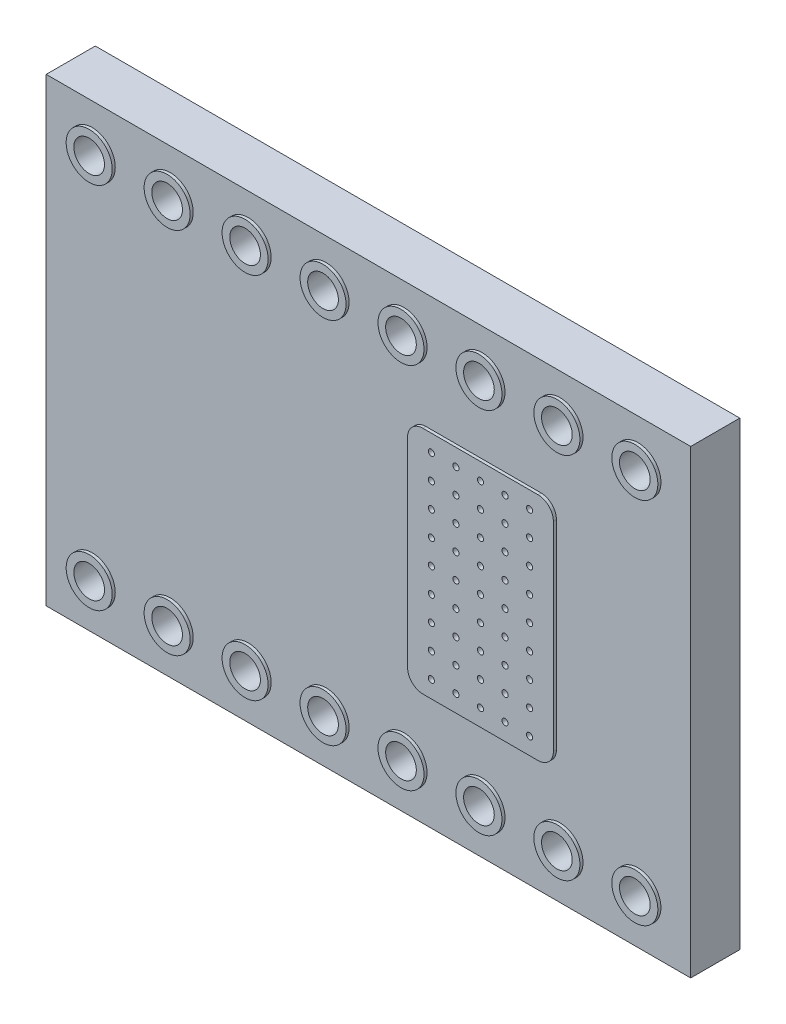
from build123d import *

# Parameters (mm, degrees)
SKETCH1_W                = 21
SKETCH1_H                = 15
BOSS_EXTRUDE1_DEPTH      = 1.6
BOSS_EXTRUDE2_DEPTH      = 0.1
BOSS_EXTRUDE2_DEPTH_BACK = 1.7
SKETCH2_R                = 0.75
SKETCH3_R                = 0.5
CUT_EXTRUDE1_DEPTH       = 2
BOSS_EXTRUDE3_DEPTH      = 0.1
BOSS_EXTRUDE3_DEPTH_BACK = 1.7
SKETCH5_R                = 0.1
CUT_EXTRUDE2_DEPTH       = 1.8


with BuildPart() as part:
    # Sketch1 → Boss-Extrude1 (new body)
    with BuildSketch(Plane.XY):
        Rectangle(SKETCH1_W, SKETCH1_H)
    extrude(amount=BOSS_EXTRUDE1_DEPTH)

    # Sketch2 → Boss-Extrude2 (add, two sides: drawn at the far end of the back side and taken through both)
    with BuildSketch(Plane.XY.offset(1.6).offset(-BOSS_EXTRUDE2_DEPTH_BACK)):
        with Locations((-9, 6)):
            Circle(SKETCH2_R)
        with Locations((-9, -6)):
            Circle(SKETCH2_R)
        with Locations((-6.46, 6)):
            Circle(SKETCH2_R)
        with Locations((-6.46, -6)):
            Circle(SKETCH2_R)
        with Locations((-3.92, 6)):
            Circle(SKETCH2_R)
        with Locations((-3.92, -6)):
            Circle(SKETCH2_R)
        with Locations((-1.38, 6)):
            Circle(SKETCH2_R)
        with Locations((-1.38, -6)):
            Circle(SKETCH2_R)
        with Locations((1.16, 6)):
            Circle(SKETCH2_R)
        with Locations((1.16, -6)):
            Circle(SKETCH2_R)
        with Locations((3.7, 6)):
            Circle(SKETCH2_R)
        with Locations((3.7, -6)):
            Circle(SKETCH2_R)
        with Locations((6.24, 6)):
            Circle(SKETCH2_R)
        with Locations((6.24, -6)):
            Circle(SKETCH2_R)
        with Locations((8.78, 6)):
            Circle(SKETCH2_R)
        with Locations((8.78, -6)):
            Circle(SKETCH2_R)
    extrude(amount=BOSS_EXTRUDE2_DEPTH + BOSS_EXTRUDE2_DEPTH_BACK)

    # Sketch3 → Cut-Extrude1 (cut)
    with BuildSketch(Plane.XY.offset(1.7)):
        with Locations((-9, 6)):
            Circle(SKETCH3_R)
        with Locations((-9, -6)):
            Circle(SKETCH3_R)
        with Locations((-6.46, 6)):
            Circle(SKETCH3_R)
        with Locations((-6.46, -6)):
            Circle(SKETCH3_R)
        with Locations((-3.92, 6)):
            Circle(SKETCH3_R)
        with Locations((-3.92, -6)):
            Circle(SKETCH3_R)
        with Locations((-1.38, 6)):
            Circle(SKETCH3_R)
        with Locations((-1.38, -6)):
            Circle(SKETCH3_R)
        with Locations((1.16, 6)):
            Circle(SKETCH3_R)
        with Locations((1.16, -6)):
            Circle(SKETCH3_R)
        with Locations((3.7, 6)):
            Circle(SKETCH3_R)
        with Locations((3.7, -6)):
            Circle(SKETCH3_R)
        with Locations((6.24, 6)):
            Circle(SKETCH3_R)
        with Locations((6.24, -6)):
            Circle(SKETCH3_R)
        with Locations((8.78, 6)):
            Circle(SKETCH3_R)
        with Locations((8.78, -6)):
            Circle(SKETCH3_R)
    extrude(amount=-CUT_EXTRUDE1_DEPTH, mode=Mode.SUBTRACT)

    # Sketch4 → Boss-Extrude3 (add, two sides: drawn at the far end of the back side and taken through both)
    with BuildSketch(Plane(origin=(0, 0, 0), x_dir=(-1, 0, 0), z_dir=(0, 0, -1)).offset(-BOSS_EXTRUDE3_DEPTH_BACK)):
        with BuildLine():
            Line((-5.625, 3.75), (-1.875, 3.75))
            ThreePointArc((-1.875, 3.75), (-1.521446609, 3.603553391), (-1.375, 3.25))
            Line((-1.375, 3.25), (-1.375, -3.25))
            ThreePointArc((-1.375, -3.25), (-1.521446609, -3.603553391), (-1.875, -3.75))
            Line((-1.875, -3.75), (-5.625, -3.75))
            ThreePointArc((-5.625, -3.75), (-5.978553391, -3.603553391), (-6.125, -3.25))
            Line((-6.125, -3.25), (-6.125, 3.25))
            ThreePointArc((-6.125, 3.25), (-5.978553391, 3.603553391), (-5.625, 3.75))
        make_face()
    extrude(amount=BOSS_EXTRUDE3_DEPTH + BOSS_EXTRUDE3_DEPTH_BACK)

    # Sketch5 → Cut-Extrude2 (cut)
    with BuildSketch(Plane(origin=(0, 0, -0.1), x_dir=(-1, 0, 0), z_dir=(0, 0, -1))):
        with Locations((-3.75, 0)):
            Circle(SKETCH5_R)
        with Locations((-2.95, 0)):
            Circle(SKETCH5_R)
        with Locations((-2.15, 0)):
            Circle(SKETCH5_R)
        with Locations((-4.55, 0)):
            Circle(SKETCH5_R)
        with Locations((-5.35, 0)):
            Circle(SKETCH5_R)
        with Locations((-3.75, -0.8)):
            Circle(SKETCH5_R)
        with Locations((-4.55, -0.8)):
            Circle(SKETCH5_R)
        with Locations((-5.35, -0.8)):
            Circle(SKETCH5_R)
        with Locations((-2.95, -0.8)):
            Circle(SKETCH5_R)
        with Locations((-2.15, -0.8)):
            Circle(SKETCH5_R)
        with Locations((-3.75, -1.6)):
            Circle(SKETCH5_R)
        with Locations((-4.55, -1.6)):
            Circle(SKETCH5_R)
        with Locations((-5.35, -1.6)):
            Circle(SKETCH5_R)
        with Locations((-2.95, -1.6)):
            Circle(SKETCH5_R)
        with Locations((-2.15, -1.6)):
            Circle(SKETCH5_R)
        with Locations((-3.75, -2.4)):
            Circle(SKETCH5_R)
        with Locations((-4.55, -2.4)):
            Circle(SKETCH5_R)
        with Locations((-5.35, -2.4)):
            Circle(SKETCH5_R)
        with Locations((-2.95, -2.4)):
            Circle(SKETCH5_R)
        with Locations((-2.15, -2.4)):
            Circle(SKETCH5_R)
        with Locations((-3.75, -3.2)):
            Circle(SKETCH5_R)
        with Locations((-4.55, -3.2)):
            Circle(SKETCH5_R)
        with Locations((-5.35, -3.2)):
            Circle(SKETCH5_R)
        with Locations((-2.95, -3.2)):
            Circle(SKETCH5_R)
        with Locations((-2.15, -3.2)):
            Circle(SKETCH5_R)
        with Locations((-3.75, 0.8)):
            Circle(SKETCH5_R)
        with Locations((-4.55, 0.8)):
            Circle(SKETCH5_R)
        with Locations((-5.35, 0.8)):
            Circle(SKETCH5_R)
        with Locations((-2.95, 0.8)):
            Circle(SKETCH5_R)
        with Locations((-2.15, 0.8)):
            Circle(SKETCH5_R)
        with Locations((-3.75, 1.6)):
            Circle(SKETCH5_R)
        with Locations((-4.55, 1.6)):
            Circle(SKETCH5_R)
        with Locations((-5.35, 1.6)):
            Circle(SKETCH5_R)
        with Locations((-2.95, 1.6)):
            Circle(SKETCH5_R)
        with Locations((-2.15, 1.6)):
            Circle(SKETCH5_R)
        with Locations((-3.75, 2.4)):
            Circle(SKETCH5_R)
        with Locations((-4.55, 2.4)):
            Circle(SKETCH5_R)
        with Locations((-5.35, 2.4)):
            Circle(SKETCH5_R)
        with Locations((-2.95, 2.4)):
            Circle(SKETCH5_R)
        with Locations((-2.15, 2.4)):
            Circle(SKETCH5_R)
        with Locations((-3.75, 3.2)):
            Circle(SKETCH5_R)
        with Locations((-4.55, 3.2)):
            Circle(SKETCH5_R)
        with Locations((-5.35, 3.2)):
            Circle(SKETCH5_R)
        with Locations((-2.95, 3.2)):
            Circle(SKETCH5_R)
        with Locations((-2.15, 3.2)):
            Circle(SKETCH5_R)
    extrude(amount=-CUT_EXTRUDE2_DEPTH, mode=Mode.SUBTRACT)


solid = part.part
